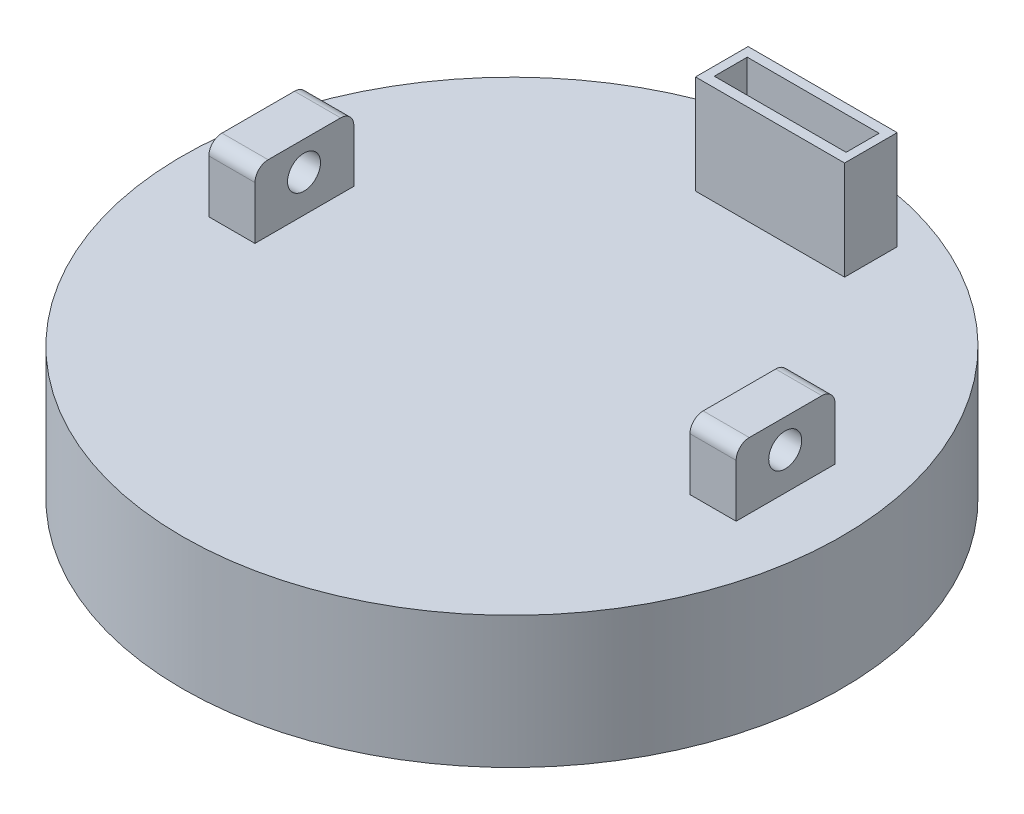
from build123d import *

# Parameters (mm, degrees)
SKETCH_2_R          = 50
EXTRUDE_1_DEPTH     = 20
SKETCH_3_W          = 7
SKETCH_3_H          = 15
EXTRUDE_2_DEPTH     = 10
SKETCH_5_R          = 2.5
CUT_EXTRUDE_1_DEPTH = 111.157271919
SKETCH_7_W          = 22.619643184
SKETCH_7_H          = 7.983403476
SKETCH_7_W_2        = 20
SKETCH_7_H_2        = 5
EXTRUDE_3_DEPTH     = 15
SKETCH_8_W          = 22.619643184
SKETCH_8_H          = 7.983403476
CUT_EXTRUDE_2_DEPTH = 5
FILLET_1_R          = 2
FILLET_2_R          = 2


with BuildPart() as part:
    # 草图2 → 凸台-拉伸1 (new body)
    with BuildSketch(Plane(origin=(0, 0, 0), x_dir=(1, 0, 0), z_dir=(0, 1, 0))):
        with Locations(Location((5.130022326, 5.987717908, 0), (0, 0, 270))):
            Circle(SKETCH_2_R)
    extrude(amount=EXTRUDE_1_DEPTH)

    # 草图3 → 凸台-拉伸2 (add)
    with BuildSketch(Plane(origin=(0, 20, 0), x_dir=(1, 0, 0), z_dir=(0, 1, 0))):
        with Locations((-31.369977674, 7.5)):
            Rectangle(SKETCH_3_W, SKETCH_3_H)
        with Locations((41.630022326, 7.5)):
            Rectangle(SKETCH_3_W, SKETCH_3_H)
    extrude(amount=EXTRUDE_2_DEPTH)

    # 草图5 → 切除-拉伸1 (cut, through all)
    with BuildSketch(Plane.ZY.offset(34.869977674)):
        with Locations((-7.44529761, 25.652801918)):
            Circle(SKETCH_5_R)
    extrude(amount=-CUT_EXTRUDE_1_DEPTH, mode=Mode.SUBTRACT)

    # 草图7 → 凸台-拉伸3 (add)
    with BuildSketch(Plane(origin=(0, 20, 0), x_dir=(1, 0, 0), z_dir=(0, 1, 0))):
        with Locations((9.977088722, 44.289046493)):
            Rectangle(SKETCH_7_W, SKETCH_7_H)
        with Locations((10, 44.317993036)):
            Rectangle(SKETCH_7_W_2, SKETCH_7_H_2, mode=Mode.SUBTRACT)
    extrude(amount=EXTRUDE_3_DEPTH)

    # 草图8 → 切除-拉伸2 (cut)
    with BuildSketch(Plane.XZ):
        with Locations((9.977088722, -44.289046493)):
            Rectangle(SKETCH_8_W, SKETCH_8_H)
    extrude(amount=-CUT_EXTRUDE_2_DEPTH, mode=Mode.SUBTRACT)

    # 圆角1
    fillet_1_edges = [part.edges().sort_by_distance(p)[0] for p in [
        (-31.369977674, 30, -15),
    ]]
    fillet(fillet_1_edges, radius=FILLET_1_R)

    # 圆角2
    fillet_2_edges = [part.edges().sort_by_distance(p)[0] for p in [
        (41.630022326, 30, 0),
        (41.630022326, 30, -15),
        (-31.369977674, 30, 0),
    ]]
    fillet(fillet_2_edges, radius=FILLET_2_R)


solid = part.part
